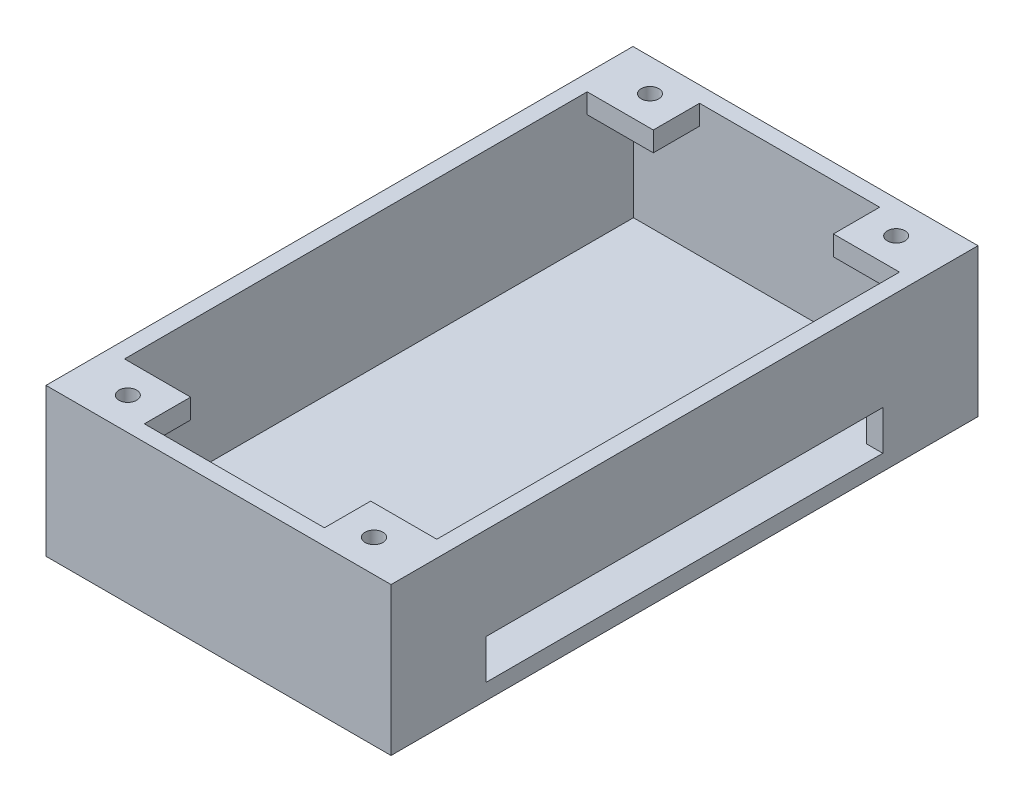
from build123d import *

# Parameters (mm, degrees)
SKETCH1_W               = 66.294
SKETCH1_H               = 112.776
BOSS_EXTRUDE1_DEPTH     = 3.048
SKETCH2_W               = 66.294
SKETCH2_H               = 112.776
SKETCH2_W_2             = 60
SKETCH2_H_2             = 106.68
BOSS_EXTRUDE2_DEPTH     = 25.4
SKETCH3_W               = 12.7
SKETCH3_H               = 8.89
BOSS_EXTRUDE3_DEPTH     = 3.81
CUT_EXTRUDE1_REACH      = 93.563
SKETCH6_W               = 76.2
SKETCH6_H               = 7.62
SKETCH7_W               = 50.8
SKETCH7_H               = 42.7
BOSS_EXTRUDE4_DEPTH     = 6.35
CUT_EXTRUDE2_DEPTH      = 90.169551737
CUT_EXTRUDE2_DEPTH_BACK = 90.169551737
CUT_EXTRUDE3_START      = -6.35
SKETCH9_W               = 22.86
SKETCH9_H               = 9.7
CUT_EXTRUDE3_DEPTH      = 6.35
CUT_EXTRUDE4_REACH      = 76.089
SKETCH4_R               = 1.7
SKETCH4_R_2             = 1.72


with BuildPart() as part:
    # Sketch1 → Boss-Extrude1 (new body)
    with BuildSketch(Plane(origin=(0, 0, 0), x_dir=(1, 0, 0), z_dir=(0, 1, 0))):
        Rectangle(SKETCH1_W, SKETCH1_H)
    extrude(amount=BOSS_EXTRUDE1_DEPTH)

    # Sketch2 → Boss-Extrude2 (add)
    with BuildSketch(Plane(origin=(0, 3.048, 0), x_dir=(1, 0, 0), z_dir=(0, 1, 0))):
        Rectangle(SKETCH2_W, SKETCH2_H)
        Rectangle(SKETCH2_W_2, SKETCH2_H_2, mode=Mode.SUBTRACT)
    extrude(amount=BOSS_EXTRUDE2_DEPTH)

    # Sketch3 → Boss-Extrude3 (add)
    with BuildSketch(Plane(origin=(0, 28.448, 0), x_dir=(1, 0, 0), z_dir=(0, 1, 0))):
        with Locations((-23.65, 48.895)):
            Rectangle(SKETCH3_W, SKETCH3_H)
        with Locations((-23.65, -48.895)):
            Rectangle(SKETCH3_W, SKETCH3_H)
        with Locations((23.65, 48.895)):
            Rectangle(SKETCH3_W, SKETCH3_H)
        with Locations((23.65, -48.895)):
            Rectangle(SKETCH3_W, SKETCH3_H)
    extrude(amount=-BOSS_EXTRUDE3_DEPTH)

    # Sketch6 → Cut-Extrude1 (cut, up to next)
    with BuildSketch(Plane(origin=(33.147, 0, 0), x_dir=(0, 0, -1), z_dir=(1, 0, 0)), mode=Mode.PRIVATE) as cut_extrude1_sk1:
        with Locations((0, 6.858)):
            Rectangle(SKETCH6_W, SKETCH6_H)
    cut_extrude1_tool1 = extrude(cut_extrude1_sk1.sketch, amount=-CUT_EXTRUDE1_REACH, mode=Mode.PRIVATE) & part.part
    add(cut_extrude1_tool1.solids().sort_by_distance((33.147, 6.858, 0))[0], mode=Mode.SUBTRACT)

    # Sketch7 → Boss-Extrude4 (add)
    with BuildSketch(Plane.XZ):
        Rectangle(SKETCH7_W, SKETCH7_H)
    extrude(amount=BOSS_EXTRUDE4_DEPTH)

    # Sketch8 → Cut-Extrude2 (cut, two sides: drawn at the far end of the back side and taken through both)
    with BuildSketch(Plane.XY.offset(21.35).offset(-CUT_EXTRUDE2_DEPTH_BACK)):
        Polygon((-3.81, -3.175), (-3.81, 0), (-25.4, 0), (-25.4, -6.35), (-11.43, -6.35), (-11.43, -3.175), align=None)
        Polygon((25.4, 0), (3.81, 0), (3.81, -3.175), (11.43, -3.175), (11.43, -6.35), (25.4, -6.35), align=None)
    extrude(amount=CUT_EXTRUDE2_DEPTH + CUT_EXTRUDE2_DEPTH_BACK, mode=Mode.SUBTRACT)

    # Sketch9 → Cut-Extrude3 (cut)
    with BuildSketch(Plane.XZ.offset(6.35).offset(CUT_EXTRUDE3_START)):
        with Locations((0, 16.5)):
            Rectangle(SKETCH9_W, SKETCH9_H)
    extrude(amount=CUT_EXTRUDE3_DEPTH, mode=Mode.SUBTRACT)

    # Sketch4 → Cut-Extrude4 (cut, up to next)
    with BuildSketch(Plane(origin=(0, 28.448, 0), x_dir=(1, 0, 0), z_dir=(0, 1, 0)), mode=Mode.PRIVATE) as cut_extrude4_sk1:
        with Locations(Location((-23.65, 50.165, 0), (0, 0, 270))):
            Circle(SKETCH4_R)
    cut_extrude4_tool1 = extrude(cut_extrude4_sk1.sketch, amount=-CUT_EXTRUDE4_REACH, mode=Mode.PRIVATE) & part.part
    # Sketch4 → Cut-Extrude4 (cut, up to next)
    with BuildSketch(Plane(origin=(0, 28.448, 0), x_dir=(1, 0, 0), z_dir=(0, 1, 0)), mode=Mode.PRIVATE) as cut_extrude4_sk2:
        with Locations(Location((23.65, 50.165, 0), (0, 0, 270))):
            Circle(SKETCH4_R)
    cut_extrude4_tool2 = extrude(cut_extrude4_sk2.sketch, amount=-CUT_EXTRUDE4_REACH, mode=Mode.PRIVATE) & part.part
    # Sketch4 → Cut-Extrude4 (cut, up to next)
    with BuildSketch(Plane(origin=(0, 28.448, 0), x_dir=(1, 0, 0), z_dir=(0, 1, 0)), mode=Mode.PRIVATE) as cut_extrude4_sk3:
        with Locations(Location((23.65, -50.165, 0), (0, 0, 270))):
            Circle(SKETCH4_R_2)
    cut_extrude4_tool3 = extrude(cut_extrude4_sk3.sketch, amount=-CUT_EXTRUDE4_REACH, mode=Mode.PRIVATE) & part.part
    # Sketch4 → Cut-Extrude4 (cut, up to next)
    with BuildSketch(Plane(origin=(0, 28.448, 0), x_dir=(1, 0, 0), z_dir=(0, 1, 0)), mode=Mode.PRIVATE) as cut_extrude4_sk4:
        with Locations(Location((-23.65, -50.165, 0), (0, 0, 270))):
            Circle(SKETCH4_R)
    cut_extrude4_tool4 = extrude(cut_extrude4_sk4.sketch, amount=-CUT_EXTRUDE4_REACH, mode=Mode.PRIVATE) & part.part
    add(cut_extrude4_tool1.solids().sort_by_distance((-23.65, 28.448, -50.165))[0], mode=Mode.SUBTRACT)
    add(cut_extrude4_tool2.solids().sort_by_distance((23.65, 28.448, -50.165))[0], mode=Mode.SUBTRACT)
    add(cut_extrude4_tool3.solids().sort_by_distance((23.65, 28.448, 50.165))[0], mode=Mode.SUBTRACT)
    add(cut_extrude4_tool4.solids().sort_by_distance((-23.65, 28.448, 50.165))[0], mode=Mode.SUBTRACT)


solid = part.part
